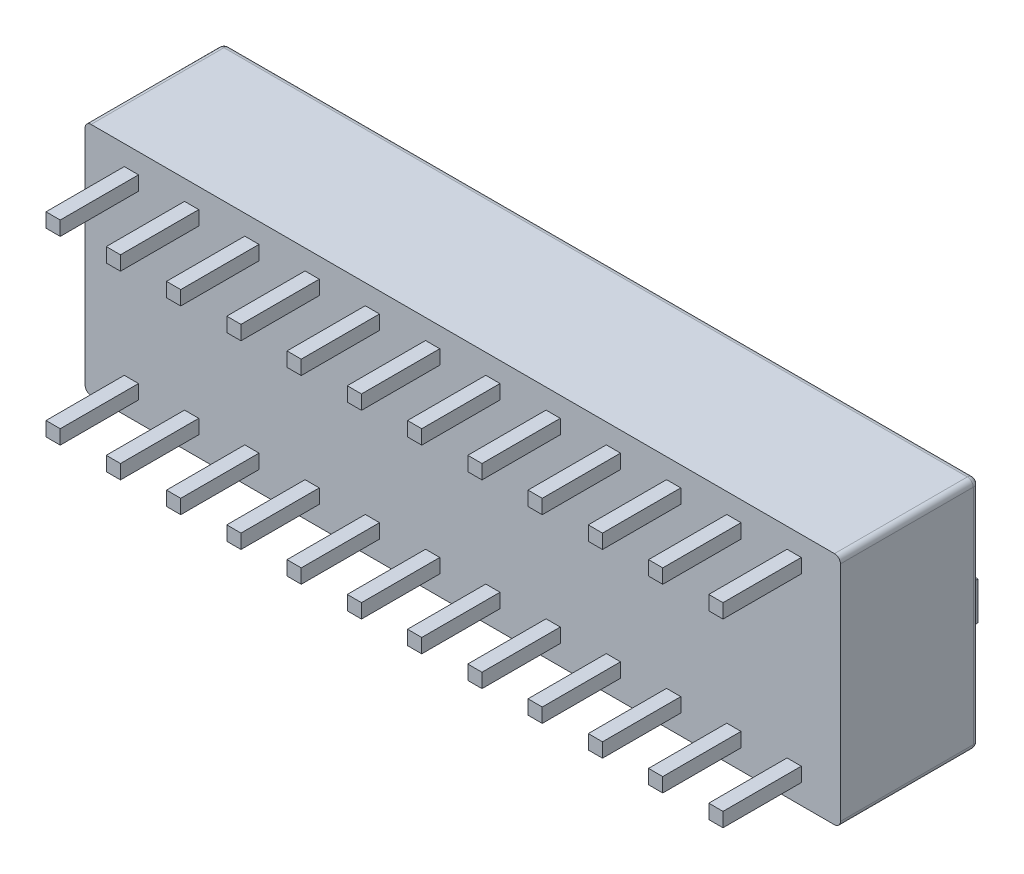
from build123d import *

# Parameters (mm, degrees)
IZIM1_W                        = 31.84
IZIM1_H                        = 9.9
Y_KSEKLIK_EKSTR_ZYON2_DEPTH    = 5.85
IZIM3_W                        = 1.4
IZIM3_H                        = 3.2
KES_EKSTR_ZYON1_DEPTH          = 1
IZIM6_W                        = 1.4
IZIM6_H                        = 1.6
Y_KSEKLIK_EKSTR_ZYON5_DEPTH    = 2.2
Y_KSEKLIK_EKSTR_ZYON5_2_DEPTH  = 2.2
Y_KSEKLIK_EKSTR_ZYON5_3_DEPTH  = 2.2
Y_KSEKLIK_EKSTR_ZYON5_4_DEPTH  = 2.2
Y_KSEKLIK_EKSTR_ZYON5_5_DEPTH  = 2.2
Y_KSEKLIK_EKSTR_ZYON5_6_DEPTH  = 2.2
Y_KSEKLIK_EKSTR_ZYON5_7_DEPTH  = 2.2
Y_KSEKLIK_EKSTR_ZYON5_8_DEPTH  = 2.2
Y_KSEKLIK_EKSTR_ZYON5_9_DEPTH  = 2.2
Y_KSEKLIK_EKSTR_ZYON5_10_DEPTH = 2.2
Y_KSEKLIK_EKSTR_ZYON5_11_DEPTH = 2.2
Y_KSEKLIK_EKSTR_ZYON5_12_DEPTH = 2.2
IZIM7_W                        = 1.4
IZIM7_H                        = 1.6
Y_KSEKLIK_EKSTR_ZYON6_DEPTH    = 0.9
Y_KSEKLIK_EKSTR_ZYON6_2_DEPTH  = 0.9
Y_KSEKLIK_EKSTR_ZYON6_3_DEPTH  = 0.9
Y_KSEKLIK_EKSTR_ZYON6_4_DEPTH  = 0.9
Y_KSEKLIK_EKSTR_ZYON6_5_DEPTH  = 0.9
Y_KSEKLIK_EKSTR_ZYON6_6_DEPTH  = 0.9
Y_KSEKLIK_EKSTR_ZYON6_7_DEPTH  = 0.9
Y_KSEKLIK_EKSTR_ZYON6_8_DEPTH  = 0.9
Y_KSEKLIK_EKSTR_ZYON6_9_DEPTH  = 0.9
Y_KSEKLIK_EKSTR_ZYON6_10_DEPTH = 0.9
Y_KSEKLIK_EKSTR_ZYON6_11_DEPTH = 0.9
Y_KSEKLIK_EKSTR_ZYON6_12_DEPTH = 0.9
RADYUS1_R                      = 0.25
IZIM8_W                        = 0.6
IZIM8_H                        = 0.6
Y_KSEKLIK_EKSTR_ZYON7_DEPTH    = 3.3


with BuildPart() as part:
    # Çizim1 → Yükseklik-Ekstrüzyon2 (new body)
    with BuildSketch(Plane.XY):
        Rectangle(IZIM1_W, IZIM1_H)
    extrude(amount=Y_KSEKLIK_EKSTR_ZYON2_DEPTH)

    # Çizim3 → Kes-Ekstrüzyon1 (cut)
    with BuildSketch(Plane(origin=(0, 0, 0), x_dir=(-1, 0, 0), z_dir=(0, 0, -1))):
        with Locations((-13.97, 0)):
            Rectangle(IZIM3_W, IZIM3_H)
        with Locations((-11.43, 0)):
            Rectangle(IZIM3_W, IZIM3_H)
        with Locations((-8.89, 0)):
            Rectangle(IZIM3_W, IZIM3_H)
        with Locations((-6.35, 0)):
            Rectangle(IZIM3_W, IZIM3_H)
        with Locations((-3.81, 0)):
            Rectangle(IZIM3_W, IZIM3_H)
        with Locations((-1.27, 0)):
            Rectangle(IZIM3_W, IZIM3_H)
        with Locations((1.27, 0)):
            Rectangle(IZIM3_W, IZIM3_H)
        with Locations((3.81, 0)):
            Rectangle(IZIM3_W, IZIM3_H)
        with Locations((6.35, 0)):
            Rectangle(IZIM3_W, IZIM3_H)
        with Locations((8.89, 0)):
            Rectangle(IZIM3_W, IZIM3_H)
        with Locations((11.43, 0)):
            Rectangle(IZIM3_W, IZIM3_H)
        with Locations((13.97, 0)):
            Rectangle(IZIM3_W, IZIM3_H)
    extrude(amount=-KES_EKSTR_ZYON1_DEPTH, mode=Mode.SUBTRACT)

    # Radyus1
    radyus1_edges = [part.edges().sort_by_distance(p)[0] for p in [
        (15.92, 4.95, 2.925),
        (15.92, 0, 0),
        (15.92, -4.95, 2.925),
        (-15.92, -4.95, 2.925),
        (0, -4.95, 0),
        (-15.92, 4.95, 2.925),
        (0, 4.95, 0),
        (-15.92, 0, 0),
    ]]
    fillet(radyus1_edges, radius=RADYUS1_R)

    # Çizim8 → Yükseklik-Ekstrüzyon7 (add)
    with BuildSketch(Plane.XY.offset(5.85)):
        with Locations((11.43, -3.81)):
            Rectangle(IZIM8_W, IZIM8_H)
        with Locations((13.97, -3.81)):
            Rectangle(IZIM8_W, IZIM8_H)
        with Locations((13.97, 3.81)):
            Rectangle(IZIM8_W, IZIM8_H)
        with Locations((11.43, 3.81)):
            Rectangle(IZIM8_W, IZIM8_H)
        with Locations((8.89, -3.81)):
            Rectangle(IZIM8_W, IZIM8_H)
        with Locations((8.89, 3.81)):
            Rectangle(IZIM8_W, IZIM8_H)
        with Locations((6.35, -3.81)):
            Rectangle(IZIM8_W, IZIM8_H)
        with Locations((6.35, 3.81)):
            Rectangle(IZIM8_W, IZIM8_H)
        with Locations((3.81, -3.81)):
            Rectangle(IZIM8_W, IZIM8_H)
        with Locations((3.81, 3.81)):
            Rectangle(IZIM8_W, IZIM8_H)
        with Locations((1.27, -3.81)):
            Rectangle(IZIM8_W, IZIM8_H)
        with Locations((1.27, 3.81)):
            Rectangle(IZIM8_W, IZIM8_H)
        with Locations((-1.27, -3.81)):
            Rectangle(IZIM8_W, IZIM8_H)
        with Locations((-1.27, 3.81)):
            Rectangle(IZIM8_W, IZIM8_H)
        with Locations((-3.81, -3.81)):
            Rectangle(IZIM8_W, IZIM8_H)
        with Locations((-3.81, 3.81)):
            Rectangle(IZIM8_W, IZIM8_H)
        with Locations((-6.35, -3.81)):
            Rectangle(IZIM8_W, IZIM8_H)
        with Locations((-6.35, 3.81)):
            Rectangle(IZIM8_W, IZIM8_H)
        with Locations((-8.89, -3.81)):
            Rectangle(IZIM8_W, IZIM8_H)
        with Locations((-8.89, 3.81)):
            Rectangle(IZIM8_W, IZIM8_H)
        with Locations((-11.43, -3.81)):
            Rectangle(IZIM8_W, IZIM8_H)
        with Locations((-11.43, 3.81)):
            Rectangle(IZIM8_W, IZIM8_H)
        with Locations((-13.97, -3.81)):
            Rectangle(IZIM8_W, IZIM8_H)
        with Locations((-13.97, 3.81)):
            Rectangle(IZIM8_W, IZIM8_H)
    extrude(amount=Y_KSEKLIK_EKSTR_ZYON7_DEPTH)


with BuildPart() as body_2:
    # Çizim6 → Yükseklik-Ekstrüzyon5 (new body)
    with BuildSketch(Plane(origin=(0, 0, 1), x_dir=(-1, 0, 0), z_dir=(0, 0, -1))):
        with Locations((-13.97, -0.8)):
            Rectangle(IZIM6_W, IZIM6_H)
    extrude(amount=Y_KSEKLIK_EKSTR_ZYON5_DEPTH)


with BuildPart() as body_3:
    # Çizim6 → Y_kseklik-Ekstr_zyon5 2 (new body)
    with BuildSketch(Plane(origin=(0, 0, 1), x_dir=(-1, 0, 0), z_dir=(0, 0, -1))):
        with Locations((-11.43, -0.8)):
            Rectangle(IZIM6_W, IZIM6_H)
    extrude(amount=Y_KSEKLIK_EKSTR_ZYON5_2_DEPTH)


with BuildPart() as body_4:
    # Çizim6 → Y_kseklik-Ekstr_zyon5 3 (new body)
    with BuildSketch(Plane(origin=(0, 0, 1), x_dir=(-1, 0, 0), z_dir=(0, 0, -1))):
        with Locations((-8.89, -0.8)):
            Rectangle(IZIM6_W, IZIM6_H)
    extrude(amount=Y_KSEKLIK_EKSTR_ZYON5_3_DEPTH)


with BuildPart() as body_5:
    # Çizim6 → Y_kseklik-Ekstr_zyon5 4 (new body)
    with BuildSketch(Plane(origin=(0, 0, 1), x_dir=(-1, 0, 0), z_dir=(0, 0, -1))):
        with Locations((-6.35, -0.8)):
            Rectangle(IZIM6_W, IZIM6_H)
    extrude(amount=Y_KSEKLIK_EKSTR_ZYON5_4_DEPTH)


with BuildPart() as body_6:
    # Çizim6 → Y_kseklik-Ekstr_zyon5 5 (new body)
    with BuildSketch(Plane(origin=(0, 0, 1), x_dir=(-1, 0, 0), z_dir=(0, 0, -1))):
        with Locations((-3.81, -0.8)):
            Rectangle(IZIM6_W, IZIM6_H)
    extrude(amount=Y_KSEKLIK_EKSTR_ZYON5_5_DEPTH)


with BuildPart() as body_7:
    # Çizim6 → Y_kseklik-Ekstr_zyon5 6 (new body)
    with BuildSketch(Plane(origin=(0, 0, 1), x_dir=(-1, 0, 0), z_dir=(0, 0, -1))):
        with Locations((-1.27, -0.8)):
            Rectangle(IZIM6_W, IZIM6_H)
    extrude(amount=Y_KSEKLIK_EKSTR_ZYON5_6_DEPTH)


with BuildPart() as body_8:
    # Çizim6 → Y_kseklik-Ekstr_zyon5 7 (new body)
    with BuildSketch(Plane(origin=(0, 0, 1), x_dir=(-1, 0, 0), z_dir=(0, 0, -1))):
        with Locations((1.27, -0.8)):
            Rectangle(IZIM6_W, IZIM6_H)
    extrude(amount=Y_KSEKLIK_EKSTR_ZYON5_7_DEPTH)


with BuildPart() as body_9:
    # Çizim6 → Y_kseklik-Ekstr_zyon5 8 (new body)
    with BuildSketch(Plane(origin=(0, 0, 1), x_dir=(-1, 0, 0), z_dir=(0, 0, -1))):
        with Locations((3.81, -0.8)):
            Rectangle(IZIM6_W, IZIM6_H)
    extrude(amount=Y_KSEKLIK_EKSTR_ZYON5_8_DEPTH)


with BuildPart() as body_10:
    # Çizim6 → Y_kseklik-Ekstr_zyon5 9 (new body)
    with BuildSketch(Plane(origin=(0, 0, 1), x_dir=(-1, 0, 0), z_dir=(0, 0, -1))):
        with Locations((6.35, -0.8)):
            Rectangle(IZIM6_W, IZIM6_H)
    extrude(amount=Y_KSEKLIK_EKSTR_ZYON5_9_DEPTH)


with BuildPart() as body_11:
    # Çizim6 → Y_kseklik-Ekstr_zyon5 10 (new body)
    with BuildSketch(Plane(origin=(0, 0, 1), x_dir=(-1, 0, 0), z_dir=(0, 0, -1))):
        with Locations((8.89, -0.8)):
            Rectangle(IZIM6_W, IZIM6_H)
    extrude(amount=Y_KSEKLIK_EKSTR_ZYON5_10_DEPTH)


with BuildPart() as body_12:
    # Çizim6 → Y_kseklik-Ekstr_zyon5 11 (new body)
    with BuildSketch(Plane(origin=(0, 0, 1), x_dir=(-1, 0, 0), z_dir=(0, 0, -1))):
        with Locations((11.43, -0.8)):
            Rectangle(IZIM6_W, IZIM6_H)
    extrude(amount=Y_KSEKLIK_EKSTR_ZYON5_11_DEPTH)


with BuildPart() as body_13:
    # Çizim6 → Y_kseklik-Ekstr_zyon5 12 (new body)
    with BuildSketch(Plane(origin=(0, 0, 1), x_dir=(-1, 0, 0), z_dir=(0, 0, -1))):
        with Locations((13.97, -0.8)):
            Rectangle(IZIM6_W, IZIM6_H)
    extrude(amount=Y_KSEKLIK_EKSTR_ZYON5_12_DEPTH)


with BuildPart() as body_14:
    # Çizim7 → Yükseklik-Ekstrüzyon6 (new body)
    with BuildSketch(Plane(origin=(0, 0, 1), x_dir=(-1, 0, 0), z_dir=(0, 0, -1))):
        with Locations((-11.43, 0.8)):
            Rectangle(IZIM7_W, IZIM7_H)
    extrude(amount=Y_KSEKLIK_EKSTR_ZYON6_DEPTH)


with BuildPart() as body_15:
    # Çizim7 → Y_kseklik-Ekstr_zyon6 2 (new body)
    with BuildSketch(Plane(origin=(0, 0, 1), x_dir=(-1, 0, 0), z_dir=(0, 0, -1))):
        with Locations((-13.97, 0.8)):
            Rectangle(IZIM7_W, IZIM7_H)
    extrude(amount=Y_KSEKLIK_EKSTR_ZYON6_2_DEPTH)


with BuildPart() as body_16:
    # Çizim7 → Y_kseklik-Ekstr_zyon6 3 (new body)
    with BuildSketch(Plane(origin=(0, 0, 1), x_dir=(-1, 0, 0), z_dir=(0, 0, -1))):
        with Locations((-8.89, 0.8)):
            Rectangle(IZIM7_W, IZIM7_H)
    extrude(amount=Y_KSEKLIK_EKSTR_ZYON6_3_DEPTH)


with BuildPart() as body_17:
    # Çizim7 → Y_kseklik-Ekstr_zyon6 4 (new body)
    with BuildSketch(Plane(origin=(0, 0, 1), x_dir=(-1, 0, 0), z_dir=(0, 0, -1))):
        with Locations((-6.35, 0.8)):
            Rectangle(IZIM7_W, IZIM7_H)
    extrude(amount=Y_KSEKLIK_EKSTR_ZYON6_4_DEPTH)


with BuildPart() as body_18:
    # Çizim7 → Y_kseklik-Ekstr_zyon6 5 (new body)
    with BuildSketch(Plane(origin=(0, 0, 1), x_dir=(-1, 0, 0), z_dir=(0, 0, -1))):
        with Locations((-3.81, 0.8)):
            Rectangle(IZIM7_W, IZIM7_H)
    extrude(amount=Y_KSEKLIK_EKSTR_ZYON6_5_DEPTH)


with BuildPart() as body_19:
    # Çizim7 → Y_kseklik-Ekstr_zyon6 6 (new body)
    with BuildSketch(Plane(origin=(0, 0, 1), x_dir=(-1, 0, 0), z_dir=(0, 0, -1))):
        with Locations((-1.27, 0.8)):
            Rectangle(IZIM7_W, IZIM7_H)
    extrude(amount=Y_KSEKLIK_EKSTR_ZYON6_6_DEPTH)


with BuildPart() as body_20:
    # Çizim7 → Y_kseklik-Ekstr_zyon6 7 (new body)
    with BuildSketch(Plane(origin=(0, 0, 1), x_dir=(-1, 0, 0), z_dir=(0, 0, -1))):
        with Locations((1.27, 0.8)):
            Rectangle(IZIM7_W, IZIM7_H)
    extrude(amount=Y_KSEKLIK_EKSTR_ZYON6_7_DEPTH)


with BuildPart() as body_21:
    # Çizim7 → Y_kseklik-Ekstr_zyon6 8 (new body)
    with BuildSketch(Plane(origin=(0, 0, 1), x_dir=(-1, 0, 0), z_dir=(0, 0, -1))):
        with Locations((3.81, 0.8)):
            Rectangle(IZIM7_W, IZIM7_H)
    extrude(amount=Y_KSEKLIK_EKSTR_ZYON6_8_DEPTH)


with BuildPart() as body_22:
    # Çizim7 → Y_kseklik-Ekstr_zyon6 9 (new body)
    with BuildSketch(Plane(origin=(0, 0, 1), x_dir=(-1, 0, 0), z_dir=(0, 0, -1))):
        with Locations((6.35, 0.8)):
            Rectangle(IZIM7_W, IZIM7_H)
    extrude(amount=Y_KSEKLIK_EKSTR_ZYON6_9_DEPTH)


with BuildPart() as body_23:
    # Çizim7 → Y_kseklik-Ekstr_zyon6 10 (new body)
    with BuildSketch(Plane(origin=(0, 0, 1), x_dir=(-1, 0, 0), z_dir=(0, 0, -1))):
        with Locations((8.89, 0.8)):
            Rectangle(IZIM7_W, IZIM7_H)
    extrude(amount=Y_KSEKLIK_EKSTR_ZYON6_10_DEPTH)


with BuildPart() as body_24:
    # Çizim7 → Y_kseklik-Ekstr_zyon6 11 (new body)
    with BuildSketch(Plane(origin=(0, 0, 1), x_dir=(-1, 0, 0), z_dir=(0, 0, -1))):
        with Locations((11.43, 0.8)):
            Rectangle(IZIM7_W, IZIM7_H)
    extrude(amount=Y_KSEKLIK_EKSTR_ZYON6_11_DEPTH)


with BuildPart() as body_25:
    # Çizim7 → Y_kseklik-Ekstr_zyon6 12 (new body)
    with BuildSketch(Plane(origin=(0, 0, 1), x_dir=(-1, 0, 0), z_dir=(0, 0, -1))):
        with Locations((13.97, 0.8)):
            Rectangle(IZIM7_W, IZIM7_H)
    extrude(amount=Y_KSEKLIK_EKSTR_ZYON6_12_DEPTH)


solid = Compound([part.part, body_2.part, body_3.part, body_4.part, body_5.part, body_6.part, body_7.part, body_8.part, body_9.part, body_10.part, body_11.part, body_12.part, body_13.part, body_14.part, body_15.part, body_16.part, body_17.part, body_18.part, body_19.part, body_20.part, body_21.part, body_22.part, body_23.part, body_24.part, body_25.part])
